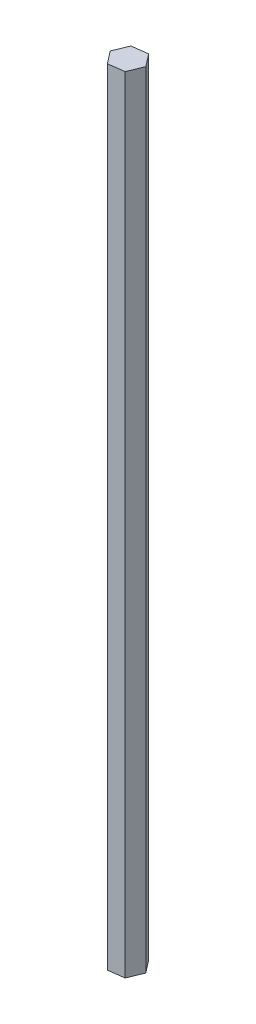
from build123d import *

# Parameters (mm, degrees)
BOSS_EXTRUDE1_DEPTH = 136.525


with BuildPart() as part:
    # Sketch1 → Boss-Extrude1 (new, symmetric)
    with BuildSketch(Plane(origin=(0, 0, 0), x_dir=(1, 0, 0), z_dir=(0, 1, 0))):
        Polygon((3.360083604, -4.353356541), (5.450159158, 0.733239489), (2.090075554, 5.08659603), (-3.360083604, 4.353356541), (-5.450159158, -0.733239489), (-2.090075554, -5.08659603), align=None)
    extrude(amount=BOSS_EXTRUDE1_DEPTH, both=True)


solid = part.part
